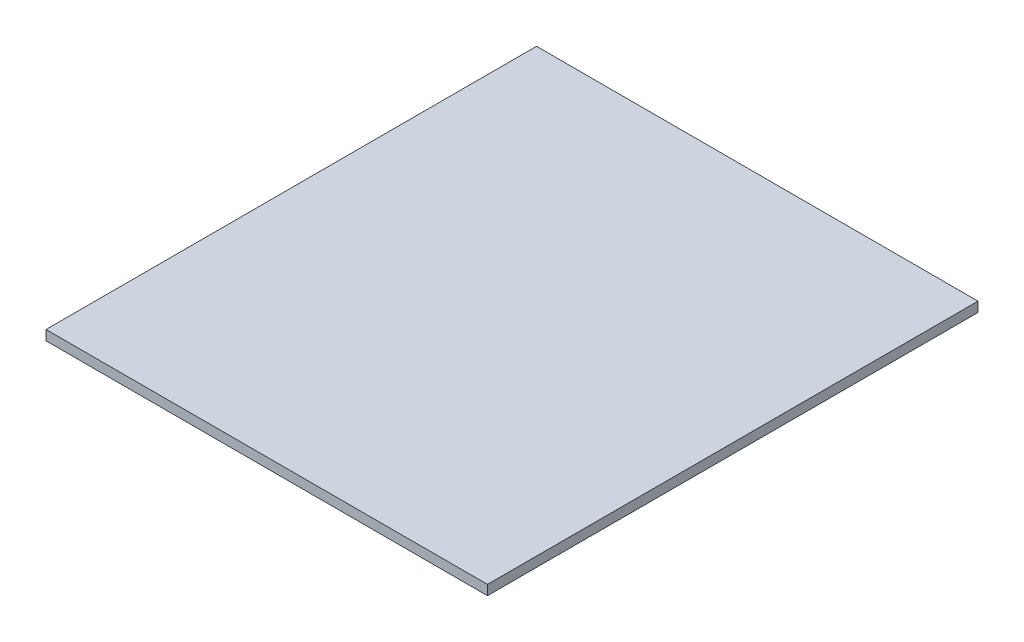
from build123d import *

# Parameters (mm, degrees)
SKETCH1_W           = 22.86
SKETCH1_H           = 25.4
BOSS_EXTRUDE1_DEPTH = 0.508


with BuildPart() as part:
    # Sketch1 → Boss-Extrude1 (new body)
    with BuildSketch(Plane(origin=(0, 0, 0), x_dir=(1, 0, 0), z_dir=(0, 1, 0))):
        with Locations((11.43, 12.7)):
            Rectangle(SKETCH1_W, SKETCH1_H)
    extrude(amount=BOSS_EXTRUDE1_DEPTH)


solid = part.part
